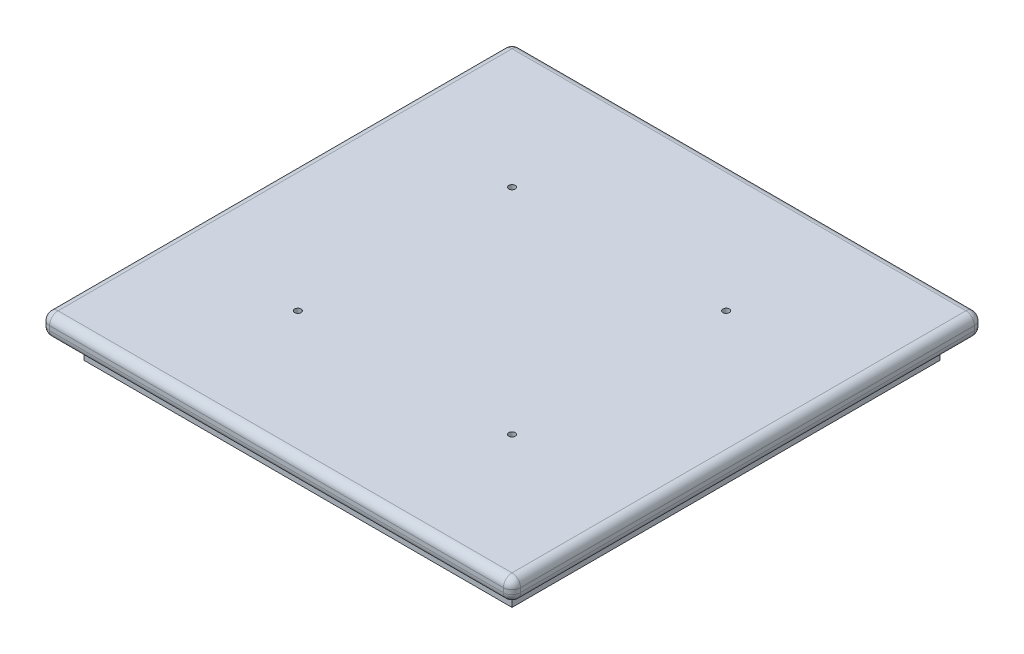
from build123d import *

# Parameters (mm, degrees)
SKETCH1_W           = 100
SKETCH1_H           = 100
SKETCH1_R           = 0.75
BOSS_EXTRUDE1_DEPTH = 10
SKETCH2_W           = 110
SKETCH2_H           = 110
SKETCH2_W_2         = 100
SKETCH2_H_2         = 100
BOSS_EXTRUDE3_DEPTH = 5
FILLET2_R           = 2


with BuildPart() as part:
    # Sketch1 → Boss-Extrude1 (new body)
    with BuildSketch(Plane(origin=(0, 0, 0), x_dir=(1, 0, 0), z_dir=(0, 1, 0))):
        Rectangle(SKETCH1_W, SKETCH1_H)
        with Locations(Location((-25, 25, 0), (0, 0, 270))):
            Circle(SKETCH1_R, mode=Mode.SUBTRACT)
        with Locations(Location((25, -25, 0), (0, 0, 90))):
            Circle(SKETCH1_R, mode=Mode.SUBTRACT)
        with Locations(Location((25, 25, 0), (0, 0, 270))):
            Circle(SKETCH1_R, mode=Mode.SUBTRACT)
        with Locations(Location((-25, -25, 0), (0, 0, 90))):
            Circle(SKETCH1_R, mode=Mode.SUBTRACT)
    extrude(amount=BOSS_EXTRUDE1_DEPTH)

    # Sketch2 → Boss-Extrude3 (add)
    with BuildSketch(Plane(origin=(0, 10, 0), x_dir=(1, 0, 0), z_dir=(0, 1, 0))):
        Rectangle(SKETCH2_W, SKETCH2_H)
        Rectangle(SKETCH2_W_2, SKETCH2_H_2, mode=Mode.SUBTRACT)
    extrude(amount=-BOSS_EXTRUDE3_DEPTH)

    # Fillet2
    fillet2_edges = [part.edges().sort_by_distance(p)[0] for p in [
        (0, 5, -55),
        (-55, 7.5, -55),
        (55, 5, 0),
        (55, 7.5, -55),
        (0, 5, 55),
        (55, 7.5, 55),
        (-55, 5, 0),
        (-55, 7.5, 55),
        (0, 10, -55),
        (-55, 10, 0),
        (0, 10, 55),
        (55, 10, 0),
    ]]
    fillet(fillet2_edges, radius=FILLET2_R)


solid = part.part
